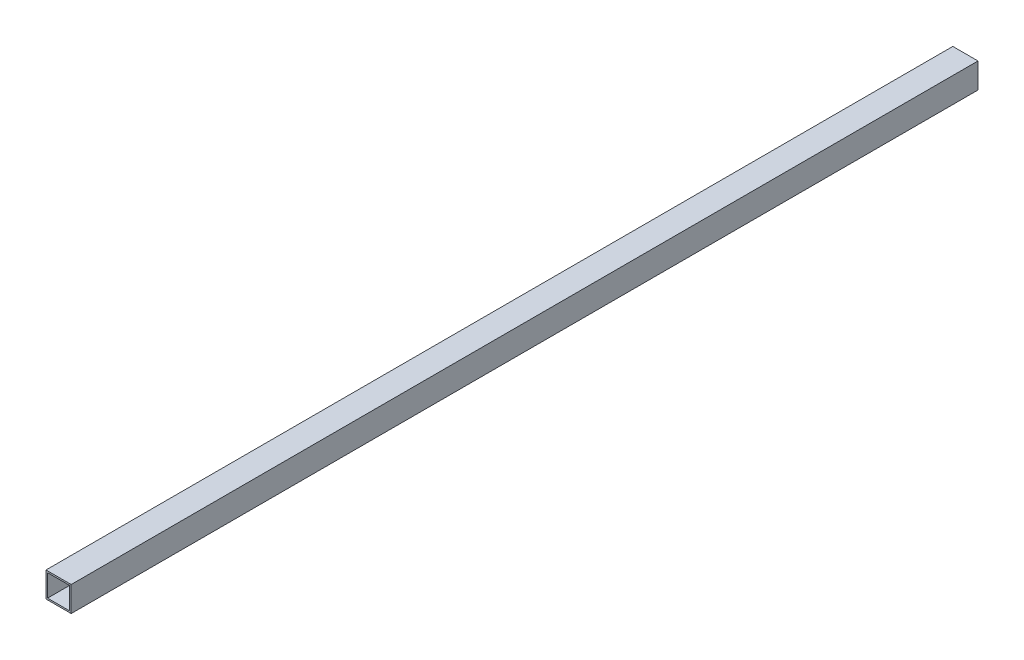
from build123d import *

# Parameters (mm, degrees)
SKETCH1_W           = 25.4
SKETCH1_H           = 25.4
SKETCH1_W_2         = 22.225
SKETCH1_H_2         = 22.225
BOSS_EXTRUDE1_DEPTH = 914.4


with BuildPart() as part:
    # Sketch1 → Boss-Extrude1 (new body)
    with BuildSketch(Plane.XY):
        Rectangle(SKETCH1_W, SKETCH1_H)
        Rectangle(SKETCH1_W_2, SKETCH1_H_2, mode=Mode.SUBTRACT)
    extrude(amount=BOSS_EXTRUDE1_DEPTH)


solid = part.part
